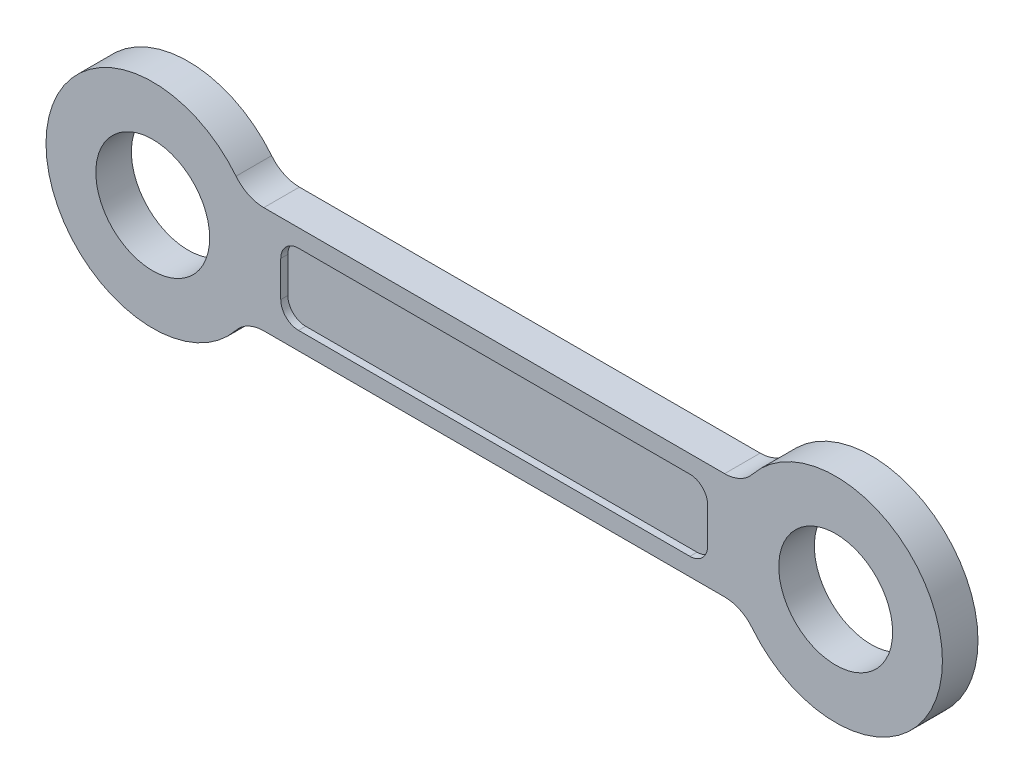
from build123d import *

# Parameters (mm, degrees)
BOSS_EXTRUDE1_DEPTH      = 5
BOSS_EXTRUDE1_DEPTH_BACK = 5
SKETCH1_R                = 16
FILLET1_R                = 10
CUT_EXTRUDE1_DEPTH       = 2


with BuildPart() as part:
    # Sketch1 → Boss-Extrude1 (new, two sides: drawn at the far end of the back side and taken through both)
    with BuildSketch(Plane.XY.offset(-BOSS_EXTRUDE1_DEPTH_BACK)):
        with BuildLine():
            Line((-70, -15), (70, -15))
            ThreePointArc((70, -15), (125.980762114, 0), (70, 15))
            Line((70, 15), (-70, 15))
            ThreePointArc((-70, 15), (-125.980762114, 0), (-70, -15))
        make_face()
        with Locations((-95.980762114, 0)):
            Circle(SKETCH1_R, mode=Mode.SUBTRACT)
        with Locations((95.980762114, 0)):
            Circle(SKETCH1_R, mode=Mode.SUBTRACT)
    extrude(amount=BOSS_EXTRUDE1_DEPTH + BOSS_EXTRUDE1_DEPTH_BACK)

    # Fillet1
    fillet1_edges = [part.edges().sort_by_distance(p)[0] for p in [
        (70, -15, 0),
        (70, 15, 0),
        (-70, 15, 0),
        (-70, -15, 0),
    ]]
    fillet(fillet1_edges, radius=FILLET1_R)

    # Sketch2 → Cut-Extrude1 (cut)
    with BuildSketch(Plane.XY.offset(5)):
        with BuildLine():
            Line((55, 10), (-55, 10))
            ThreePointArc((-55, 10), (-58.535533906, 8.535533906), (-60, 5))
            Line((-60, 5), (-60, -5))
            ThreePointArc((-60, -5), (-58.535533906, -8.535533906), (-55, -10))
            Line((-55, -10), (55, -10))
            ThreePointArc((55, -10), (58.535533906, -8.535533906), (60, -5))
            Line((60, -5), (60, 5))
            ThreePointArc((60, 5), (58.535533906, 8.535533906), (55, 10))
        make_face()
    cut_extrude1 = extrude(amount=-CUT_EXTRUDE1_DEPTH, mode=Mode.SUBTRACT)

    # Mirror4: Cut-Extrude1 across plane
    add(cut_extrude1.mirror(Plane.XY), mode=Mode.SUBTRACT)


solid = part.part
